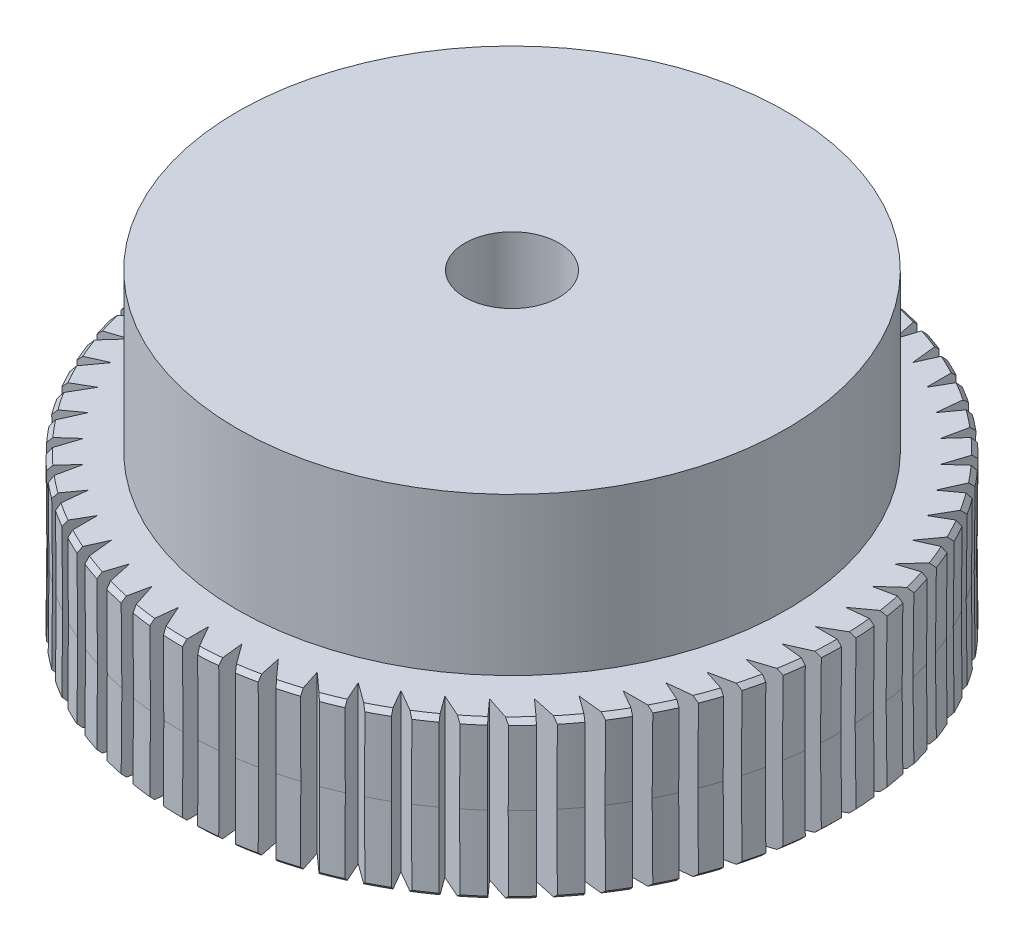
from build123d import *

# Parameters (mm, degrees)
SKETCH_1_R          = 21
EXTRUDE_1_DEPTH     = 10
SKETCH_2_R          = 17.5
EXTRUDE_2_DEPTH     = 10
CUT_EXTRUDE_START   = -35
CUT_EXTRUDE_1_DEPTH = 35
SKETCH_4_R          = 3
CUT_EXTRUDE_2_DEPTH = 36.80502758


with BuildPart() as part:
    # 草图1 → 凸台-拉伸1 (new body)
    with BuildSketch(Plane(origin=(0, 0, 0), x_dir=(1, 0, 0), z_dir=(0, 1, 0))):
        with Locations(Location((0, 0, 0), (0, 0, 270))):
            Circle(SKETCH_1_R)
    extrude(amount=EXTRUDE_1_DEPTH)

    # 草图2 → 凸台-拉伸2 (add)
    with BuildSketch(Plane(origin=(0, 10, 0), x_dir=(1, 0, 0), z_dir=(0, 1, 0))):
        with Locations(Location((0, 0, 0), (0, 0, 270))):
            Circle(SKETCH_2_R)
    extrude(amount=EXTRUDE_2_DEPTH)

    # 草图3 → 切除-拉伸1 (cut)
    with BuildSketch(Plane(origin=(0, 10, 0), x_dir=(1, 0, 0), z_dir=(0, 1, 0)).offset(CUT_EXTRUDE_START)):
        with BuildLine():
            Line((0, -21), (0, -19.336565443))
            Line((0, -19.336565443), (0.948023499, -20.978590311))
            ThreePointArc((0.948023499, -20.978590311), (0.474132611, -20.994646896), (0, -21))
        make_face()
        with BuildLine():
            Line((-2.021221471, -19.230637715), (-1.250029679, -20.962762838))
            ThreePointArc((-1.250029679, -20.962762838), (-1.723002914, -20.929196376), (-2.195097729, -20.884959803))
            Line((-2.195097729, -20.884959803), (-2.021221471, -19.230637715))
        make_face()
        with BuildLine():
            Line((-4.020298016, -18.914015095), (-3.434387271, -20.717262948))
            ThreePointArc((-3.434387271, -20.717262948), (-3.901260859, -20.634441202), (-4.366145507, -20.541099615))
            Line((-4.366145507, -20.541099615), (-4.020298016, -18.914015095))
        make_face()
        with BuildLine():
            Line((-5.975327335, -18.390166568), (-5.581116997, -20.244780391))
            ThreePointArc((-5.581116997, -20.244780391), (-6.036775773, -20.113610772), (-6.489356882, -19.972186842))
            Line((-6.489356882, -19.972186842), (-5.975327335, -18.390166568))
        make_face()
        with BuildLine():
            Line((-7.864889717, -17.664831527), (-7.666698838, -19.550491782))
            ThreePointArc((-7.666698838, -19.550491782), (-8.106150508, -19.372411413), (-8.541469505, -19.18445461))
            Line((-8.541469505, -19.18445461), (-7.864889717, -17.664831527))
        make_face()
        with BuildLine():
            Line((-9.668282722, -16.745956896), (-9.668282722, -18.642003895))
            ThreePointArc((-9.668282722, -18.642003895), (-10.086712562, -18.41896386), (-10.5, -18.186533479))
            Line((-10.5, -18.186533479), (-9.668282722, -16.745956896))
        make_face()
        with BuildLine():
            Line((-11.365747998, -15.643610056), (-11.563938877, -17.529270312))
            ThreePointArc((-11.563938877, -17.529270312), (-11.956762483, -17.263714286), (-12.343490298, -16.989356882))
            Line((-12.343490298, -16.989356882), (-11.365747998, -15.643610056))
        make_face()
        with BuildLine():
            Line((-12.93868776, -14.369868552), (-13.332898097, -16.224482375))
            ThreePointArc((-13.332898097, -16.224482375), (-13.695811611, -15.919319844), (-14.051742734, -15.606041335))
            Line((-14.051742734, -15.606041335), (-12.93868776, -14.369868552))
        make_face()
        with BuildLine():
            Line((-14.369868552, -12.93868776), (-14.955779297, -14.741935614))
            ThreePointArc((-14.955779297, -14.741935614), (-15.284806562, -14.400510004), (-15.606041335, -14.051742734))
            Line((-15.606041335, -14.051742734), (-14.369868552, -12.93868776))
        make_face()
        with BuildLine():
            Line((-15.643610056, -11.365747998), (-16.414801848, -13.097873121))
            ThreePointArc((-16.414801848, -13.097873121), (-16.706337973, -12.723925162), (-16.989356882, -12.343490298))
            Line((-16.989356882, -12.343490298), (-15.643610056, -11.365747998))
        make_face()
        with BuildLine():
            Line((-16.745956896, -9.668282722), (-17.693980395, -11.31030759))
            ThreePointArc((-17.693980395, -11.31030759), (-17.94483125, -10.907934333), (-18.186533479, -10.5))
            Line((-18.186533479, -10.5), (-16.745956896, -9.668282722))
        make_face()
        with BuildLine():
            Line((-17.664831527, -7.864889717), (-18.779299991, -9.398823961))
            ThreePointArc((-18.779299991, -9.398823961), (-18.9867172, -8.972433894), (-19.18445461, -8.541469505))
            Line((-19.18445461, -8.541469505), (-17.664831527, -7.864889717))
        make_face()
        with BuildLine():
            Line((-18.390166568, -5.975327335), (-19.658869646, -7.384364851))
            ThreePointArc((-19.658869646, -7.384364851), (-19.820580703, -6.938629591), (-19.972186842, -6.489356882))
            Line((-19.972186842, -6.489356882), (-18.390166568, -5.975327335))
        make_face()
        with BuildLine():
            Line((-18.914015095, -4.020298016), (-20.323052611, -5.289001094))
            ThreePointArc((-20.323052611, -5.289001094), (-20.437285776, -4.82880421), (-20.541099615, -4.366145507))
            Line((-20.541099615, -4.366145507), (-18.914015095, -4.020298016))
        make_face()
        with BuildLine():
            Line((-19.230637715, -2.021221471), (-20.764571959, -3.135689934))
            ThreePointArc((-20.764571959, -3.135689934), (-20.83007567, -2.66607344), (-20.884959803, -2.195097729))
            Line((-20.884959803, -2.195097729), (-19.230637715, -2.021221471))
        make_face()
        with BuildLine():
            Line((-19.336565443, 0), (-20.978590311, -0.948023499))
            ThreePointArc((-20.978590311, -0.948023499), (-20.994646896, -0.474132611), (-21, 0))
            Line((-21, 0), (-19.336565443, 0))
        make_face()
        with BuildLine():
            Line((-19.230637715, 2.021221471), (-20.962762838, 1.250029679))
            ThreePointArc((-20.962762838, 1.250029679), (-20.929196376, 1.723002914), (-20.884959803, 2.195097729))
            Line((-20.884959803, 2.195097729), (-19.230637715, 2.021221471))
        make_face()
        with BuildLine():
            Line((-18.914015095, 4.020298016), (-20.717262948, 3.434387271))
            ThreePointArc((-20.717262948, 3.434387271), (-20.634441202, 3.901260859), (-20.541099615, 4.366145507))
            Line((-20.541099615, 4.366145507), (-18.914015095, 4.020298016))
        make_face()
        with BuildLine():
            Line((-18.390166568, 5.975327335), (-20.244780391, 5.581116997))
            ThreePointArc((-20.244780391, 5.581116997), (-20.113610772, 6.036775773), (-19.972186842, 6.489356882))
            Line((-19.972186842, 6.489356882), (-18.390166568, 5.975327335))
        make_face()
        with BuildLine():
            Line((-17.664831527, 7.864889717), (-19.550491782, 7.666698838))
            ThreePointArc((-19.550491782, 7.666698838), (-19.372411413, 8.106150508), (-19.18445461, 8.541469505))
            Line((-19.18445461, 8.541469505), (-17.664831527, 7.864889717))
        make_face()
        with BuildLine():
            Line((-16.745956896, 9.668282722), (-18.642003895, 9.668282722))
            ThreePointArc((-18.642003895, 9.668282722), (-18.41896386, 10.086712562), (-18.186533479, 10.5))
            Line((-18.186533479, 10.5), (-16.745956896, 9.668282722))
        make_face()
        with BuildLine():
            Line((-15.643610056, 11.365747998), (-17.529270312, 11.563938877))
            ThreePointArc((-17.529270312, 11.563938877), (-17.263714286, 11.956762483), (-16.989356882, 12.343490298))
            Line((-16.989356882, 12.343490298), (-15.643610056, 11.365747998))
        make_face()
        with BuildLine():
            Line((-14.369868552, 12.93868776), (-16.224482375, 13.332898097))
            ThreePointArc((-16.224482375, 13.332898097), (-15.919319844, 13.695811611), (-15.606041335, 14.051742734))
            Line((-15.606041335, 14.051742734), (-14.369868552, 12.93868776))
        make_face()
        with BuildLine():
            Line((-12.93868776, 14.369868552), (-14.741935614, 14.955779297))
            ThreePointArc((-14.741935614, 14.955779297), (-14.400510004, 15.284806562), (-14.051742734, 15.606041335))
            Line((-14.051742734, 15.606041335), (-12.93868776, 14.369868552))
        make_face()
        with BuildLine():
            Line((-11.365747998, 15.643610056), (-13.097873121, 16.414801848))
            ThreePointArc((-13.097873121, 16.414801848), (-12.723925162, 16.706337973), (-12.343490298, 16.989356882))
            Line((-12.343490298, 16.989356882), (-11.365747998, 15.643610056))
        make_face()
        with BuildLine():
            Line((-9.668282722, 16.745956896), (-11.31030759, 17.693980395))
            ThreePointArc((-11.31030759, 17.693980395), (-10.907934333, 17.94483125), (-10.5, 18.186533479))
            Line((-10.5, 18.186533479), (-9.668282722, 16.745956896))
        make_face()
        with BuildLine():
            Line((-7.864889717, 17.664831527), (-9.398823961, 18.779299991))
            ThreePointArc((-9.398823961, 18.779299991), (-8.972433894, 18.9867172), (-8.541469505, 19.18445461))
            Line((-8.541469505, 19.18445461), (-7.864889717, 17.664831527))
        make_face()
        with BuildLine():
            Line((-5.975327335, 18.390166568), (-7.384364851, 19.658869646))
            ThreePointArc((-7.384364851, 19.658869646), (-6.938629591, 19.820580703), (-6.489356882, 19.972186842))
            Line((-6.489356882, 19.972186842), (-5.975327335, 18.390166568))
        make_face()
        with BuildLine():
            Line((-4.020298016, 18.914015095), (-5.289001094, 20.323052611))
            ThreePointArc((-5.289001094, 20.323052611), (-4.82880421, 20.437285776), (-4.366145507, 20.541099615))
            Line((-4.366145507, 20.541099615), (-4.020298016, 18.914015095))
        make_face()
        with BuildLine():
            Line((-2.021221471, 19.230637715), (-3.135689934, 20.764571959))
            ThreePointArc((-3.135689934, 20.764571959), (-2.66607344, 20.83007567), (-2.195097729, 20.884959803))
            Line((-2.195097729, 20.884959803), (-2.021221471, 19.230637715))
        make_face()
        with BuildLine():
            Line((0, 19.336565443), (-0.948023499, 20.978590311))
            ThreePointArc((-0.948023499, 20.978590311), (-0.474132611, 20.994646896), (0, 21))
            Line((0, 21), (0, 19.336565443))
        make_face()
        with BuildLine():
            Line((2.021221471, 19.230637715), (1.250029679, 20.962762838))
            ThreePointArc((1.250029679, 20.962762838), (1.723002914, 20.929196376), (2.195097729, 20.884959803))
            Line((2.195097729, 20.884959803), (2.021221471, 19.230637715))
        make_face()
        with BuildLine():
            Line((4.020298016, 18.914015095), (3.434387271, 20.717262948))
            ThreePointArc((3.434387271, 20.717262948), (3.901260859, 20.634441202), (4.366145507, 20.541099615))
            Line((4.366145507, 20.541099615), (4.020298016, 18.914015095))
        make_face()
        with BuildLine():
            Line((5.975327335, 18.390166568), (5.581116997, 20.244780391))
            ThreePointArc((5.581116997, 20.244780391), (6.036775773, 20.113610772), (6.489356882, 19.972186842))
            Line((6.489356882, 19.972186842), (5.975327335, 18.390166568))
        make_face()
        with BuildLine():
            Line((7.864889717, 17.664831527), (7.666698838, 19.550491782))
            ThreePointArc((7.666698838, 19.550491782), (8.106150508, 19.372411413), (8.541469505, 19.18445461))
            Line((8.541469505, 19.18445461), (7.864889717, 17.664831527))
        make_face()
        with BuildLine():
            Line((9.668282722, 16.745956896), (9.668282722, 18.642003895))
            ThreePointArc((9.668282722, 18.642003895), (10.086712562, 18.41896386), (10.5, 18.186533479))
            Line((10.5, 18.186533479), (9.668282722, 16.745956896))
        make_face()
        with BuildLine():
            Line((11.365747998, 15.643610056), (11.563938877, 17.529270312))
            ThreePointArc((11.563938877, 17.529270312), (11.956762483, 17.263714286), (12.343490298, 16.989356882))
            Line((12.343490298, 16.989356882), (11.365747998, 15.643610056))
        make_face()
        with BuildLine():
            Line((12.93868776, 14.369868552), (13.332898097, 16.224482375))
            ThreePointArc((13.332898097, 16.224482375), (13.695811611, 15.919319844), (14.051742734, 15.606041335))
            Line((14.051742734, 15.606041335), (12.93868776, 14.369868552))
        make_face()
        with BuildLine():
            Line((14.369868552, 12.93868776), (14.955779297, 14.741935614))
            ThreePointArc((14.955779297, 14.741935614), (15.284806562, 14.400510004), (15.606041335, 14.051742734))
            Line((15.606041335, 14.051742734), (14.369868552, 12.93868776))
        make_face()
        with BuildLine():
            Line((15.643610056, 11.365747998), (16.414801848, 13.097873121))
            ThreePointArc((16.414801848, 13.097873121), (16.706337973, 12.723925162), (16.989356882, 12.343490298))
            Line((16.989356882, 12.343490298), (15.643610056, 11.365747998))
        make_face()
        with BuildLine():
            Line((16.745956896, 9.668282722), (17.693980395, 11.31030759))
            ThreePointArc((17.693980395, 11.31030759), (17.94483125, 10.907934333), (18.186533479, 10.5))
            Line((18.186533479, 10.5), (16.745956896, 9.668282722))
        make_face()
        with BuildLine():
            Line((17.664831527, 7.864889717), (18.779299991, 9.398823961))
            ThreePointArc((18.779299991, 9.398823961), (18.9867172, 8.972433894), (19.18445461, 8.541469505))
            Line((19.18445461, 8.541469505), (17.664831527, 7.864889717))
        make_face()
        with BuildLine():
            Line((18.390166568, 5.975327335), (19.658869646, 7.384364851))
            ThreePointArc((19.658869646, 7.384364851), (19.820580703, 6.938629591), (19.972186842, 6.489356882))
            Line((19.972186842, 6.489356882), (18.390166568, 5.975327335))
        make_face()
        with BuildLine():
            Line((18.914015095, 4.020298016), (20.323052611, 5.289001094))
            ThreePointArc((20.323052611, 5.289001094), (20.437285776, 4.82880421), (20.541099615, 4.366145507))
            Line((20.541099615, 4.366145507), (18.914015095, 4.020298016))
        make_face()
        with BuildLine():
            Line((19.230637715, 2.021221471), (20.764571959, 3.135689934))
            ThreePointArc((20.764571959, 3.135689934), (20.83007567, 2.66607344), (20.884959803, 2.195097729))
            Line((20.884959803, 2.195097729), (19.230637715, 2.021221471))
        make_face()
        with BuildLine():
            Line((19.336565443, 0), (20.978590311, 0.948023499))
            ThreePointArc((20.978590311, 0.948023499), (20.994646896, 0.474132611), (21, 0))
            Line((21, 0), (19.336565443, 0))
        make_face()
        with BuildLine():
            Line((19.230637715, -2.021221471), (20.962762838, -1.250029679))
            ThreePointArc((20.962762838, -1.250029679), (20.929196376, -1.723002914), (20.884959803, -2.195097729))
            Line((20.884959803, -2.195097729), (19.230637715, -2.021221471))
        make_face()
        with BuildLine():
            Line((18.914015095, -4.020298016), (20.717262948, -3.434387271))
            ThreePointArc((20.717262948, -3.434387271), (20.634441202, -3.901260859), (20.541099615, -4.366145507))
            Line((20.541099615, -4.366145507), (18.914015095, -4.020298016))
        make_face()
        with BuildLine():
            Line((18.390166568, -5.975327335), (20.244780391, -5.581116997))
            ThreePointArc((20.244780391, -5.581116997), (20.113610772, -6.036775773), (19.972186842, -6.489356882))
            Line((19.972186842, -6.489356882), (18.390166568, -5.975327335))
        make_face()
        with BuildLine():
            Line((17.664831527, -7.864889717), (19.550491782, -7.666698838))
            ThreePointArc((19.550491782, -7.666698838), (19.372411413, -8.106150508), (19.18445461, -8.541469505))
            Line((19.18445461, -8.541469505), (17.664831527, -7.864889717))
        make_face()
        with BuildLine():
            Line((16.745956896, -9.668282722), (18.642003895, -9.668282722))
            ThreePointArc((18.642003895, -9.668282722), (18.41896386, -10.086712562), (18.186533479, -10.5))
            Line((18.186533479, -10.5), (16.745956896, -9.668282722))
        make_face()
        with BuildLine():
            Line((15.643610056, -11.365747998), (17.529270312, -11.563938877))
            ThreePointArc((17.529270312, -11.563938877), (17.263714286, -11.956762483), (16.989356882, -12.343490298))
            Line((16.989356882, -12.343490298), (15.643610056, -11.365747998))
        make_face()
        with BuildLine():
            Line((14.369868552, -12.93868776), (16.224482375, -13.332898097))
            ThreePointArc((16.224482375, -13.332898097), (15.919319844, -13.695811611), (15.606041335, -14.051742734))
            Line((15.606041335, -14.051742734), (14.369868552, -12.93868776))
        make_face()
        with BuildLine():
            Line((12.93868776, -14.369868552), (14.741935614, -14.955779297))
            ThreePointArc((14.741935614, -14.955779297), (14.400510004, -15.284806562), (14.051742734, -15.606041335))
            Line((14.051742734, -15.606041335), (12.93868776, -14.369868552))
        make_face()
        with BuildLine():
            Line((11.365747998, -15.643610056), (13.097873121, -16.414801848))
            ThreePointArc((13.097873121, -16.414801848), (12.723925162, -16.706337973), (12.343490298, -16.989356882))
            Line((12.343490298, -16.989356882), (11.365747998, -15.643610056))
        make_face()
        with BuildLine():
            Line((9.668282722, -16.745956896), (11.31030759, -17.693980395))
            ThreePointArc((11.31030759, -17.693980395), (10.907934333, -17.94483125), (10.5, -18.186533479))
            Line((10.5, -18.186533479), (9.668282722, -16.745956896))
        make_face()
        with BuildLine():
            Line((7.864889717, -17.664831527), (9.398823961, -18.779299991))
            ThreePointArc((9.398823961, -18.779299991), (8.972433894, -18.9867172), (8.541469505, -19.18445461))
            Line((8.541469505, -19.18445461), (7.864889717, -17.664831527))
        make_face()
        with BuildLine():
            Line((5.975327335, -18.390166568), (7.384364851, -19.658869646))
            ThreePointArc((7.384364851, -19.658869646), (6.938629591, -19.820580703), (6.489356882, -19.972186842))
            Line((6.489356882, -19.972186842), (5.975327335, -18.390166568))
        make_face()
        with BuildLine():
            Line((4.020298016, -18.914015095), (5.289001094, -20.323052611))
            ThreePointArc((5.289001094, -20.323052611), (4.82880421, -20.437285776), (4.366145507, -20.541099615))
            Line((4.366145507, -20.541099615), (4.020298016, -18.914015095))
        make_face()
        with BuildLine():
            Line((2.021221471, -19.230637715), (3.135689934, -20.764571959))
            ThreePointArc((3.135689934, -20.764571959), (2.66607344, -20.83007567), (2.195097729, -20.884959803))
            Line((2.195097729, -20.884959803), (2.021221471, -19.230637715))
        make_face()
    extrude(amount=CUT_EXTRUDE_1_DEPTH, mode=Mode.SUBTRACT)

    # 草图4 → 切除-拉伸2 (cut, through all)
    with BuildSketch(Plane(origin=(0, 20, 0), x_dir=(1, 0, 0), z_dir=(0, 1, 0))):
        with Locations(Location((0, 0, 0), (0, 0, 270))):
            Circle(SKETCH_4_R)
    extrude(amount=-CUT_EXTRUDE_2_DEPTH, mode=Mode.SUBTRACT)

    # 草图6 → 切除-旋转1 (revolve, cut)
    with BuildSketch(Plane(origin=(0, 0, 0), x_dir=(0, 0, -1), z_dir=(1, 0, 0))):
        Polygon((20.717262948, 10), (21, 9.717262948), (20.962762838, 5), (21, 0.282737052), (20.717262948, 0), (24.519517608, 0), (24.519517608, 10), align=None)
    revolve(axis=Axis((0, 0, 0), (0, 1, 0)), mode=Mode.SUBTRACT)


solid = part.part
